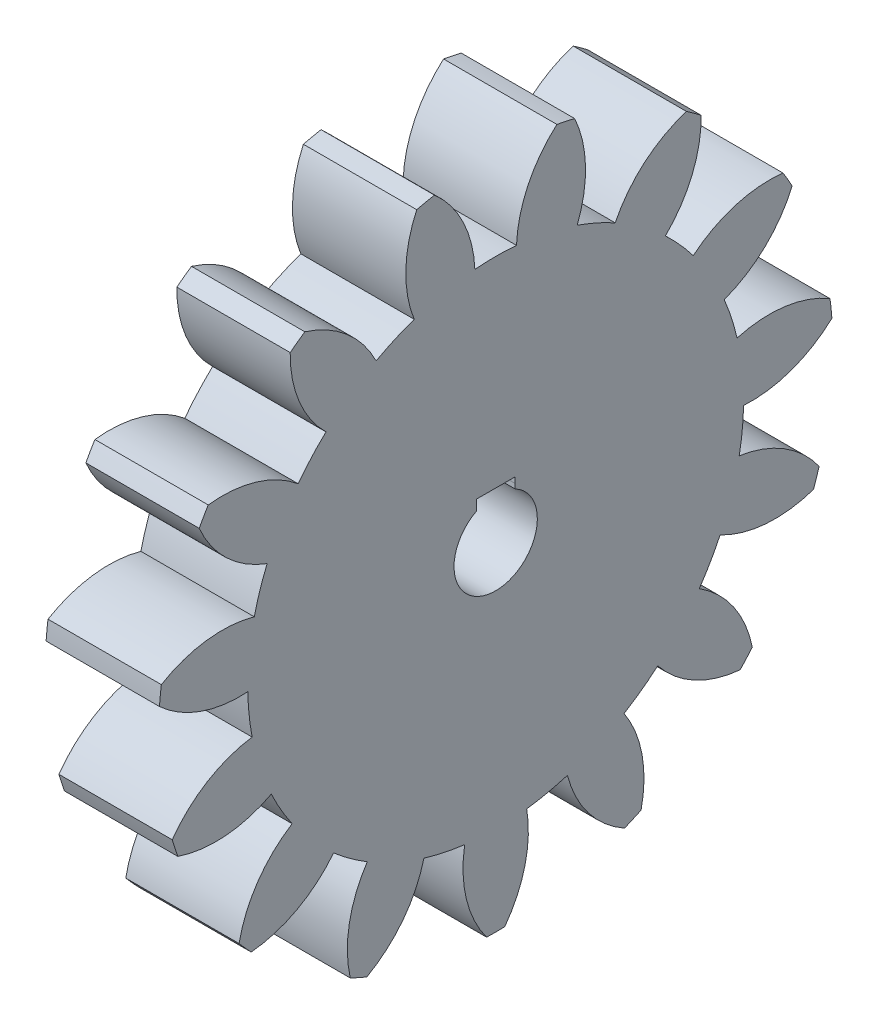
from build123d import *

# Parameters (mm, degrees)
BASPROSKE_W             = 10
BASPROSKE_H             = 29.75
TOOTHCUT_DEPTH          = 44.244941901
TEETHCUTS_COUNT         = 15
TEETHCUTS_ANGLE         = 336
BORSKE_R                = 3.5
BORE_DEPTH              = 50.0000508
SKETCH1_R               = 3.675
CUT_EXTRUDE1_DEPTH      = 10
CUT_EXTRUDE2_DEPTH      = 44.183025
CUT_EXTRUDE2_DEPTH_BACK = 44.183025


with BuildPart() as part:
    # BasProSke → Base-Revolve (revolve)
    with BuildSketch(Plane(origin=(0, 0, 0), x_dir=(1, 0, 0), z_dir=(0, 1, 0)), mode=Mode.PRIVATE) as base_revolve_sk:
        with Locations((5, 14.875)):
            Rectangle(BASPROSKE_W, BASPROSKE_H)
    revolve(base_revolve_sk.sketch.rotate(Axis((-10, 0, 0), (1, 0, 0)), 180), axis=Axis((-10, 0, 0), (1, 0, 0)))

    # TooCutSke → ToothCut (cut, through all)
    with BuildSketch(Plane(origin=(0, 0, 0), x_dir=(0, 0, -1), z_dir=(1, 0, 0))):
        with BuildLine():
            ThreePointArc((1.837264636, 21.796704674), (0, 21.874), (-1.837264636, 21.796704674))
            ThreePointArc((-1.837264636, 21.796704674), (-2.861169083, 25.906231304), (-5.425297323, 29.27696354))
            ThreePointArc((-5.425297323, 29.27696354), (0, 29.7754), (5.425297323, 29.27696354))
            ThreePointArc((5.425297323, 29.27696354), (2.861169083, 25.906231304), (1.837264636, 21.796704674))
        make_face()
    toothcut = extrude(amount=TOOTHCUT_DEPTH, mode=Mode.SUBTRACT)

    # TeethCuts: ToothCut ×15 about axis
    teethcuts_axis = Axis((-10, 0, 0), (1, 0, 0))
    for i in range(1, TEETHCUTS_COUNT):
        add(toothcut.rotate(teethcuts_axis, i * TEETHCUTS_ANGLE / (TEETHCUTS_COUNT - 1)), mode=Mode.SUBTRACT)

    # BorSke → Bore (cut, symmetric)
    with BuildSketch(Plane(origin=(0, 0, 0), x_dir=(0, 0, -1), z_dir=(1, 0, 0))):
        with Locations(Location((0, 0, 0), (0, 0, 180))):
            Circle(BORSKE_R)
    extrude(amount=BORE_DEPTH, both=True, mode=Mode.SUBTRACT)

    # Sketch1 → Cut-Extrude1 (cut)
    with BuildSketch(Plane(origin=(10, 0, 0), x_dir=(0, 0, -1), z_dir=(1, 0, 0))):
        Circle(SKETCH1_R)
    extrude(amount=-CUT_EXTRUDE1_DEPTH, mode=Mode.SUBTRACT)

    # Sketch2 → Cut-Extrude2 (cut, two sides: drawn at the far end of the back side and taken through both)
    with BuildSketch(Plane(origin=(10, 0, 0), x_dir=(0, 0, -1), z_dir=(1, 0, 0)).offset(-CUT_EXTRUDE2_DEPTH_BACK)):
        with BuildLine():
            Line((1.71, 3.252925606), (1.71, 3.675))
            Line((1.71, 3.675), (1.71, 4.175))
            Line((1.71, 4.175), (-1.71, 4.175))
            Line((-1.71, 4.175), (-1.71, 3.675))
            Line((-1.71, 3.675), (-1.71, 3.252925606))
            ThreePointArc((-1.71, 3.252925606), (-0.880659809, 3.567921426), (0, 3.675))
            ThreePointArc((0, 3.675), (0.880659809, 3.567921426), (1.71, 3.252925606))
        make_face()
    extrude(amount=CUT_EXTRUDE2_DEPTH + CUT_EXTRUDE2_DEPTH_BACK, mode=Mode.SUBTRACT)


solid = part.part
